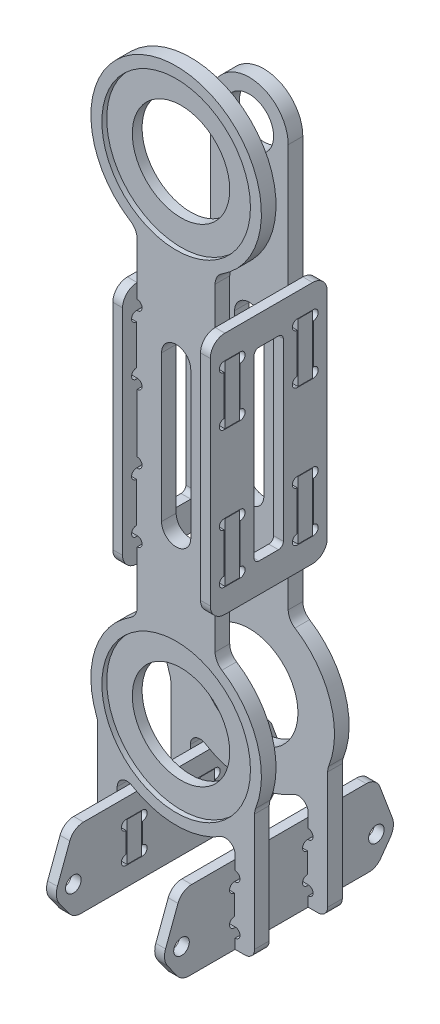
from build123d import *

# Parameters (mm, degrees)
EXTRUDE_START       = 10.1
SKETCH_2_R          = 1.6
EXTRUDE_1_DEPTH     = 2
FILLET_1_R          = 3
SKETCH_3_R          = 10
EXTRUDE_2_DEPTH     = 1.5
FILLET_2_R          = 2
FILLET_3_R          = 3
SKETCH_4_R          = 5
SKETCH_4_R_2        = 10
EXTRUDE_3_DEPTH     = 1.5
SKETCH_5_R          = 15.25
CUT_EXTRUDE_1_DEPTH = 1
SKETCH_6_W          = 24
SKETCH_6_H          = 50
SKETCH_6_W_2        = 6
SKETCH_6_H_2        = 38
EXTRUDE_4_DEPTH     = 2
FILLET_4_R          = 3
FILLET_5_R          = 1


with BuildPart() as part:
    # 草图2 → 凸台-拉伸1 (new body)
    with BuildSketch(Plane(origin=(0, 0, 0), x_dir=(0, 0, -1), z_dir=(1, 0, 0)).offset(EXTRUDE_START)):
        with BuildLine():
            Line((20, -33.5), (-20, -33.5))
            Line((-20, -33.5), (-22.842815017, -29.541666667))
            ThreePointArc((-22.842815017, -29.541666667), (-23.46926239, -27.962837409), (-23.278623949, -26.275))
            Line((-23.278623949, -26.275), (-20, -17.5))
            Line((-20, -17.5), (20, -17.5))
            Line((20, -17.5), (23.278623949, -26.275))
            ThreePointArc((23.278623949, -26.275), (23.46926239, -27.962837409), (22.842815017, -29.541666667))
            Line((22.842815017, -29.541666667), (20, -33.5))
        make_face()
        with Locations((-20, -27.5)):
            Circle(SKETCH_2_R, mode=Mode.SUBTRACT)
        with Locations(Location((20, -27.5, 0), (0, 0, 180))):
            Circle(SKETCH_2_R, mode=Mode.SUBTRACT)
        with BuildLine():
            Line((5.85, -21.4), (9.15, -21.4))
            ThreePointArc((9.15, -21.4), (10.15, -22.4), (9.15, -23.4))
            Line((9.15, -23.4), (9.15, -27.6))
            ThreePointArc((9.15, -27.6), (10.15, -28.6), (9.15, -29.6))
            Line((9.15, -29.6), (5.85, -29.6))
            ThreePointArc((5.85, -29.6), (4.85, -28.6), (5.85, -27.6))
            Line((5.85, -27.6), (5.85, -23.4))
            ThreePointArc((5.85, -23.4), (4.85, -22.4), (5.85, -21.4))
        make_face(mode=Mode.SUBTRACT)
        with BuildLine():
            Line((-5.85, -21.4), (-9.15, -21.4))
            ThreePointArc((-9.15, -21.4), (-10.15, -22.4), (-9.15, -23.4))
            Line((-9.15, -23.4), (-9.15, -27.6))
            ThreePointArc((-9.15, -27.6), (-10.15, -28.6), (-9.15, -29.6))
            Line((-9.15, -29.6), (-5.85, -29.6))
            ThreePointArc((-5.85, -29.6), (-4.85, -28.6), (-5.85, -27.6))
            Line((-5.85, -27.6), (-5.85, -23.4))
            ThreePointArc((-5.85, -23.4), (-4.85, -22.4), (-5.85, -21.4))
        make_face(mode=Mode.SUBTRACT)
    extrude(amount=EXTRUDE_1_DEPTH)

    # 圆角1
    fillet_1_edges = [part.edges().sort_by_distance(p)[0] for p in [
        (11.1, -33.5, -20),
        (11.1, -33.5, 20),
        (11.1, -17.5, 20),
        (11.1, -17.5, -20),
    ]]
    fillet(fillet_1_edges, radius=FILLET_1_R)


with BuildPart() as body_2:
    # 镜向2: mirrored copy
    add(part.part.mirror(Plane(origin=(0, 0, 0), x_dir=(0, 0, 1), z_dir=(1, 0, 0))))


with BuildPart() as body_3:
    # 草图3 → 凸台-拉伸2 (new, symmetric)
    with BuildSketch(Plane(origin=(0, 0, 7.5), x_dir=(-1, 0, 0), z_dir=(0, 0, -1))):
        with BuildLine():
            Line((-12.1, -21.5), (-10.1, -21.5))
            Line((-10.1, -21.5), (-10.1, -29.5))
            Line((-10.1, -29.5), (-12.1, -29.5))
            ThreePointArc((-12.1, -29.5), (-13.1, -30.5), (-12.1, -31.5))
            Line((-12.1, -31.5), (-12.1, -33.5))
            Line((-12.1, -33.5), (-16.1, -33.5))
            Line((-16.1, -33.5), (-16.1, -6.85857128))
            ThreePointArc((-16.1, -6.85857128), (-16.459031354, 5.945610724), (-8, 15.564382416))
            Line((-8, 15.564382416), (-8, 28))
            ThreePointArc((-8, 28), (-7, 29), (-8, 30))
            Line((-8, 30), (-10, 30))
            Line((-10, 30), (-10, 42))
            Line((-10, 42), (-8, 42))
            ThreePointArc((-8, 42), (-7, 43), (-8, 44))
            Line((-8, 44), (-8, 56))
            ThreePointArc((-8, 56), (-7, 57), (-8, 58))
            Line((-8, 58), (-10, 58))
            Line((-10, 58), (-10, 70))
            Line((-10, 70), (-8, 70))
            ThreePointArc((-8, 70), (-7, 71), (-8, 72))
            Line((-8, 72), (-8, 84.435617584))
            ThreePointArc((-8, 84.435617584), (0, 117.5), (8, 84.435617584))
            Line((8, 84.435617584), (8, 72))
            ThreePointArc((8, 72), (7, 71), (8, 70))
            Line((8, 70), (10, 70))
            Line((10, 70), (10, 58))
            Line((10, 58), (8, 58))
            ThreePointArc((8, 58), (7, 57), (8, 56))
            Line((8, 56), (8, 44))
            ThreePointArc((8, 44), (7, 43), (8, 42))
            Line((8, 42), (10, 42))
            Line((10, 42), (10, 30))
            Line((10, 30), (8, 30))
            ThreePointArc((8, 30), (7, 29), (8, 28))
            Line((8, 28), (8, 15.564382416))
            ThreePointArc((8, 15.564382416), (16.459031354, 5.945610724), (16.1, -6.85857128))
            Line((16.1, -6.85857128), (16.1, -33.5))
            Line((16.1, -33.5), (12.1, -33.5))
            Line((12.1, -33.5), (12.1, -31.5))
            ThreePointArc((12.1, -31.5), (13.1, -30.5), (12.1, -29.5))
            Line((12.1, -29.5), (10.1, -29.5))
            Line((10.1, -29.5), (10.1, -21.5))
            Line((10.1, -21.5), (12.1, -21.5))
            ThreePointArc((12.1, -21.5), (13.1, -20.5), (12.1, -19.5))
            Line((12.1, -19.5), (12.1, -12.642784503))
            ThreePointArc((12.1, -12.642784503), (0, -17.5), (-12.1, -12.642784503))
            Line((-12.1, -12.642784503), (-12.1, -19.5))
            ThreePointArc((-12.1, -19.5), (-13.1, -20.5), (-12.1, -21.5))
        make_face()
        Circle(SKETCH_3_R, mode=Mode.SUBTRACT)
        with Locations((0, 100)):
            Circle(SKETCH_3_R, mode=Mode.SUBTRACT)
        with BuildLine():
            Line((-3, 35), (-3, 65))
            ThreePointArc((-3, 65), (0, 68), (3, 65))
            Line((3, 65), (3, 35))
            ThreePointArc((3, 35), (0, 32), (-3, 35))
        make_face(mode=Mode.SUBTRACT)
    extrude(amount=EXTRUDE_2_DEPTH, both=True)

    # 圆角2
    fillet_2_edges = [body_3.edges().sort_by_distance(p)[0] for p in [
        (-16.1, -33.5, 7.5),
        (-12.1, -12.642784503, 7.5),
        (12.1, -12.642784503, 7.5),
        (16.1, -33.5, 7.5),
    ]]
    fillet(fillet_2_edges, radius=FILLET_2_R)

    # 圆角3
    fillet_3_edges = [body_3.edges().sort_by_distance(p)[0] for p in [
        (-8, 84.435617584, 7.5),
        (-8, 15.564382416, 7.5),
        (-16.1, -6.85857128, 7.5),
        (16.1, -6.85857128, 7.5),
        (8, 15.564382416, 7.5),
        (8, 84.435617584, 7.5),
    ]]
    fillet(fillet_3_edges, radius=FILLET_3_R)

    # 草图5 → 切除-拉伸1 (cut)
    with BuildSketch(Plane.XY.offset(9)):
        with Locations((0, 100)):
            Circle(SKETCH_5_R)
        Circle(SKETCH_5_R)
    extrude(amount=-CUT_EXTRUDE_1_DEPTH, mode=Mode.SUBTRACT)


with BuildPart() as body_4:
    # 草图4 → 凸台-拉伸3 (new, symmetric)
    with BuildSketch(Plane.XY.offset(-7.5)):
        with BuildLine():
            Line((-8, 72), (-8, 100))
            ThreePointArc((-8, 100), (0, 108), (8, 100))
            Line((8, 100), (8, 72))
            ThreePointArc((8, 72), (7, 71), (8, 70))
            Line((8, 70), (10, 70))
            Line((10, 70), (10, 58))
            Line((10, 58), (8, 58))
            ThreePointArc((8, 58), (7, 57), (8, 56))
            Line((8, 56), (8, 44))
            ThreePointArc((8, 44), (7, 43), (8, 42))
            Line((8, 42), (10, 42))
            Line((10, 42), (10, 30))
            Line((10, 30), (8, 30))
            ThreePointArc((8, 30), (7, 29), (8, 28))
            Line((8, 28), (8, 17.298843892))
            ThreePointArc((8, 17.298843892), (8.370430806, 15.854764305), (9.390243902, 14.767305761))
            ThreePointArc((9.390243902, 14.767305761), (16.631601714, 5.444246911), (16.304878049, -6.356174306))
            ThreePointArc((16.304878049, -6.356174306), (16.15166438, -6.891442326), (16.1, -7.445804188))
            Line((16.1, -7.445804188), (16.1, -31.5))
            ThreePointArc((16.1, -31.5), (15.514213562, -32.914213562), (14.1, -33.5))
            Line((14.1, -33.5), (12.1, -33.5))
            Line((12.1, -33.5), (12.1, -31.5))
            ThreePointArc((12.1, -31.5), (13.1, -30.5), (12.1, -29.5))
            Line((12.1, -29.5), (10.1, -29.5))
            Line((10.1, -29.5), (10.1, -21.5))
            Line((10.1, -21.5), (12.1, -21.5))
            ThreePointArc((12.1, -21.5), (13.1, -20.5), (12.1, -19.5))
            Line((12.1, -19.5), (12.1, -16.68052757))
            ThreePointArc((12.1, -16.68052757), (11.081887246, -14.93814488), (9.064102564, -14.969704229))
            ThreePointArc((9.064102564, -14.969704229), (0, -17.5), (-9.064102564, -14.969704229))
            ThreePointArc((-9.064102564, -14.969704229), (-11.081887246, -14.93814488), (-12.1, -16.68052757))
            Line((-12.1, -16.68052757), (-12.1, -19.5))
            ThreePointArc((-12.1, -19.5), (-13.1, -20.5), (-12.1, -21.5))
            Line((-12.1, -21.5), (-10.1, -21.5))
            Line((-10.1, -21.5), (-10.1, -29.5))
            Line((-10.1, -29.5), (-12.1, -29.5))
            ThreePointArc((-12.1, -29.5), (-13.1, -30.5), (-12.1, -31.5))
            Line((-12.1, -31.5), (-12.1, -33.5))
            Line((-12.1, -33.5), (-14.1, -33.5))
            ThreePointArc((-14.1, -33.5), (-15.514213562, -32.914213562), (-16.1, -31.5))
            Line((-16.1, -31.5), (-16.1, -7.445804188))
            ThreePointArc((-16.1, -7.445804188), (-16.15166438, -6.891442326), (-16.304878049, -6.356174306))
            ThreePointArc((-16.304878049, -6.356174306), (-16.631601714, 5.444246911), (-9.390243902, 14.767305761))
            ThreePointArc((-9.390243902, 14.767305761), (-8.370430806, 15.854764305), (-8, 17.298843892))
            Line((-8, 17.298843892), (-8, 28))
            ThreePointArc((-8, 28), (-7, 29), (-8, 30))
            Line((-8, 30), (-10, 30))
            Line((-10, 30), (-10, 42))
            Line((-10, 42), (-8, 42))
            ThreePointArc((-8, 42), (-7, 43), (-8, 44))
            Line((-8, 44), (-8, 56))
            ThreePointArc((-8, 56), (-7, 57), (-8, 58))
            Line((-8, 58), (-10, 58))
            Line((-10, 58), (-10, 70))
            Line((-10, 70), (-8, 70))
            ThreePointArc((-8, 70), (-7, 71), (-8, 72))
        make_face()
        with Locations((0, 100)):
            Circle(SKETCH_4_R, mode=Mode.SUBTRACT)
        Circle(SKETCH_4_R_2, mode=Mode.SUBTRACT)
        with BuildLine():
            Line((-3, 35), (-3, 65))
            ThreePointArc((-3, 65), (0, 68), (3, 65))
            Line((3, 65), (3, 35))
            ThreePointArc((3, 35), (0, 32), (-3, 35))
        make_face(mode=Mode.SUBTRACT)
    extrude(amount=EXTRUDE_3_DEPTH, both=True)


with BuildPart() as body_5:
    # 草图6 → 凸台-拉伸4 (new body)
    with BuildSketch(Plane.ZY.offset(10)):
        with Locations((0, 50)):
            Rectangle(SKETCH_6_W, SKETCH_6_H)
        with Locations((0, 50)):
            Rectangle(SKETCH_6_W_2, SKETCH_6_H_2, mode=Mode.SUBTRACT)
        with BuildLine():
            Line((-9.15, 68.1), (-9.15, 59.9))
            ThreePointArc((-9.15, 59.9), (-10.15, 58.9), (-9.15, 57.9))
            Line((-9.15, 57.9), (-5.85, 57.9))
            ThreePointArc((-5.85, 57.9), (-4.85, 58.9), (-5.85, 59.9))
            Line((-5.85, 59.9), (-5.85, 68.1))
            ThreePointArc((-5.85, 68.1), (-4.85, 69.1), (-5.85, 70.1))
            Line((-5.85, 70.1), (-9.15, 70.1))
            ThreePointArc((-9.15, 70.1), (-10.15, 69.1), (-9.15, 68.1))
        make_face(mode=Mode.SUBTRACT)
        with BuildLine():
            Line((9.15, 70.1), (5.85, 70.1))
            ThreePointArc((5.85, 70.1), (4.85, 69.1), (5.85, 68.1))
            Line((5.85, 68.1), (5.85, 59.9))
            ThreePointArc((5.85, 59.9), (4.85, 58.9), (5.85, 57.9))
            Line((5.85, 57.9), (9.15, 57.9))
            ThreePointArc((9.15, 57.9), (10.15, 58.9), (9.15, 59.9))
            Line((9.15, 59.9), (9.15, 68.1))
            ThreePointArc((9.15, 68.1), (10.15, 69.1), (9.15, 70.1))
        make_face(mode=Mode.SUBTRACT)
        with BuildLine():
            Line((-9.15, 29.9), (-5.85, 29.9))
            ThreePointArc((-5.85, 29.9), (-4.85, 30.9), (-5.85, 31.9))
            Line((-5.85, 31.9), (-5.85, 40.1))
            ThreePointArc((-5.85, 40.1), (-4.85, 41.1), (-5.85, 42.1))
            Line((-5.85, 42.1), (-9.15, 42.1))
            ThreePointArc((-9.15, 42.1), (-10.15, 41.1), (-9.15, 40.1))
            Line((-9.15, 40.1), (-9.15, 31.9))
            ThreePointArc((-9.15, 31.9), (-10.15, 30.9), (-9.15, 29.9))
        make_face(mode=Mode.SUBTRACT)
        with BuildLine():
            Line((9.15, 29.9), (5.85, 29.9))
            ThreePointArc((5.85, 29.9), (4.85, 30.9), (5.85, 31.9))
            Line((5.85, 31.9), (5.85, 40.1))
            ThreePointArc((5.85, 40.1), (4.85, 41.1), (5.85, 42.1))
            Line((5.85, 42.1), (9.15, 42.1))
            ThreePointArc((9.15, 42.1), (10.15, 41.1), (9.15, 40.1))
            Line((9.15, 40.1), (9.15, 31.9))
            ThreePointArc((9.15, 31.9), (10.15, 30.9), (9.15, 29.9))
        make_face(mode=Mode.SUBTRACT)
    extrude(amount=-EXTRUDE_4_DEPTH)

    # 圆角4
    fillet_4_edges = [body_5.edges().sort_by_distance(p)[0] for p in [
        (-9, 25, 12),
        (-9, 25, -12),
        (-9, 75, -12),
        (-9, 75, 12),
    ]]
    fillet(fillet_4_edges, radius=FILLET_4_R)

    # 圆角5
    fillet_5_edges = [body_5.edges().sort_by_distance(p)[0] for p in [
        (-9, 69, 3),
        (-9, 31, 3),
        (-9, 31, -3),
        (-9, 69, -3),
    ]]
    fillet(fillet_5_edges, radius=FILLET_5_R)


with BuildPart() as body_6:
    # 镜向4: mirrored copy
    add(body_5.part.mirror(Plane(origin=(0, 0, 0), x_dir=(0, 0, 1), z_dir=(1, 0, 0))))


solid = Compound([part.part, body_2.part, body_3.part, body_4.part, body_5.part, body_6.part])
